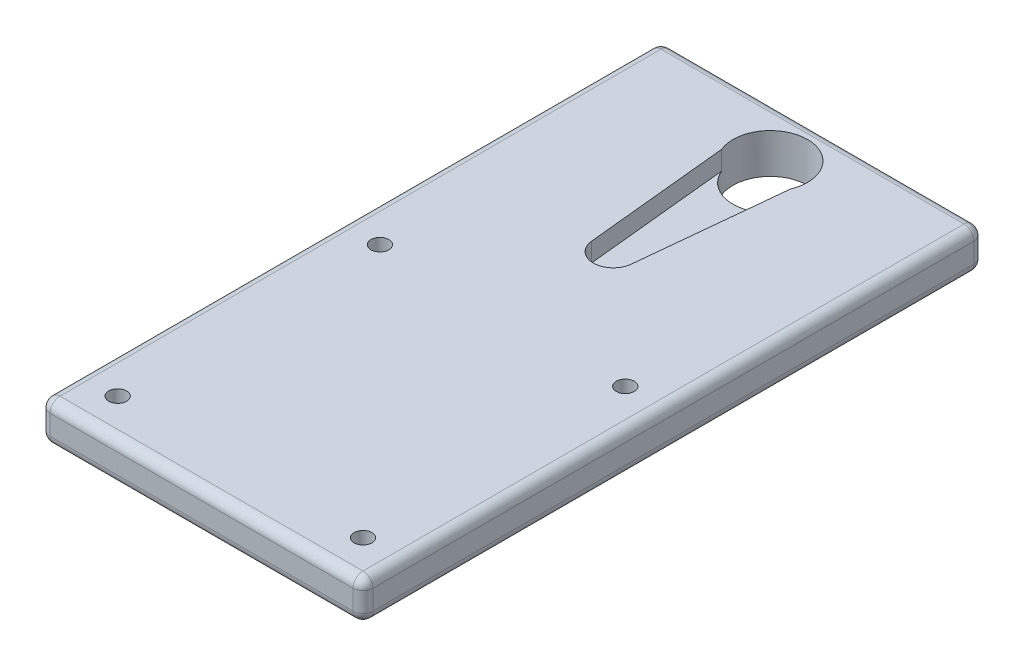
from build123d import *

# Parameters (mm, degrees)
SKETCH1_W                     = 32.5
SKETCH1_H                     = 62.5
BASE_DEPTH                    = 4
SERVO_ARM_SLOT_DEPTH          = 1.9
SKETCH3_R                     = 3.75
SERVO_ARM_MOUNTING_HOLE_DEPTH = 65.612092521
SKETCH4_R                     = 0.9
SCANNER_MOUNTING_HOLES_DEPTH  = 65.701719452
MOUNTING_HOLE_CHAMFERS_SIZE   = 1
FILLET1_R                     = 1


with BuildPart() as part:
    # Sketch1 → Base (new body)
    with BuildSketch(Plane(origin=(0, 0, 0), x_dir=(1, 0, 0), z_dir=(0, 1, 0))):
        with Locations((0, 31.25)):
            Rectangle(SKETCH1_W, SKETCH1_H)
    extrude(amount=BASE_DEPTH)

    # Sketch2 → Servo Arm Slot (cut)
    with BuildSketch(Plane(origin=(0, 4, 0), x_dir=(1, 0, 0), z_dir=(0, 1, 0))):
        with BuildLine():
            Line((-3.46455, 55.814941361), (-2, 41.250001361))
            ThreePointArc((-2, 41.250001361), (0, 39.441022081), (2, 41.250001361))
            Line((2, 41.250001361), (3.46455, 55.814941361))
            ThreePointArc((3.46455, 55.814941361), (0, 61), (-3.46455, 55.814941361))
        make_face()
    extrude(amount=-SERVO_ARM_SLOT_DEPTH, mode=Mode.SUBTRACT)

    # Sketch3 → Servo Arm Mounting Hole (cut, through all)
    with BuildSketch(Plane(origin=(0, 2.1, 0), x_dir=(1, 0, 0), z_dir=(0, 1, 0))):
        with Locations(Location((0, 57.25, 0), (0, 0, 270))):
            Circle(SKETCH3_R)
    extrude(amount=-SERVO_ARM_MOUNTING_HOLE_DEPTH, mode=Mode.SUBTRACT)

    # Sketch4 → Scanner Mounting Holes (cut, through all)
    with BuildSketch(Plane.XZ):
        with Locations(Location((-12.35, -3.9, 0), (0, 0, 270))):
            Circle(SKETCH4_R)
        with Locations(Location((-12.35, -30.3, 0), (0, 0, 270))):
            Circle(SKETCH4_R)
        with Locations(Location((12.35, -30.3, 0), (0, 0, 90))):
            Circle(SKETCH4_R)
        with Locations(Location((12.35, -3.9, 0), (0, 0, 90))):
            Circle(SKETCH4_R)
    extrude(amount=-SCANNER_MOUNTING_HOLES_DEPTH, mode=Mode.SUBTRACT)

    # Mounting Hole Chamfers
    mounting_hole_chamfers_edges = [part.edges().sort_by_distance(p)[0] for p in [
        (12.35, 0, -4.8),
        (12.35, 0, -31.2),
        (-12.35, 0, -29.4),
        (-12.35, 0, -3),
    ]]
    chamfer(mounting_hole_chamfers_edges, length=MOUNTING_HOLE_CHAMFERS_SIZE)

    # Fillet1
    fillet1_edges = [part.edges().sort_by_distance(p)[0] for p in [
        (16.25, 4, -31.25),
        (0, 4, -62.5),
        (-16.25, 4, -31.25),
        (0, 0, -62.5),
        (16.25, 0, -31.25),
        (0, 0, 0),
        (-16.25, 0, -31.25),
        (-16.25, 2, -62.5),
        (16.25, 2, -62.5),
        (16.25, 2, 0),
        (-16.25, 2, 0),
        (0, 4, 0),
    ]]
    fillet(fillet1_edges, radius=FILLET1_R)


solid = part.part
